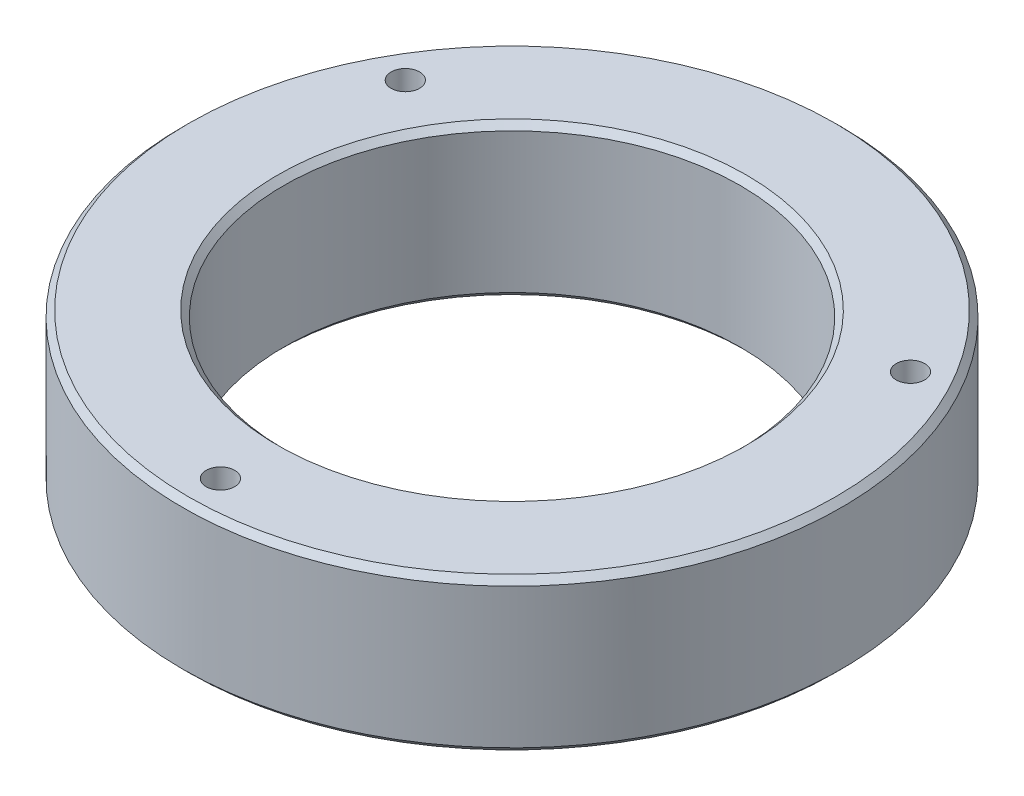
from build123d import *

# Parameters (mm, degrees)
SKETCH1_W                                        = 38.1
SKETCH1_H                                        = 25.3746
CBORE_FOR_1_4_SOCKET_HEAD_CAP_SCREW1_D           = 7.1374
CBORE_FOR_1_4_SOCKET_HEAD_CAP_SCREW1_DEPTH       = 38.1
CBORE_FOR_1_4_SOCKET_HEAD_CAP_SCREW1_CBORE_D     = 11.1252
CBORE_FOR_1_4_SOCKET_HEAD_CAP_SCREW1_CBORE_DEPTH = 9.652
CBORE_FOR_1_4_SOCKET_HEAD_CAP_SCREW1_TIP         = 2.144291291
CUT_EXTRUDE2_START                               = -19.05
SKETCH4_R                                        = 3.96875
CUT_EXTRUDE2_DEPTH                               = 25.4
CHAMFER1_SIZE                                    = 1.524


with BuildPart() as part:
    # Sketch1 → Revolve1 (revolve)
    with BuildSketch(Plane(origin=(0, 0, 0), x_dir=(0, 1, 0), z_dir=(0, 0, 1)), mode=Mode.PRIVATE) as revolve1_sk:
        with Locations((0, 69.8373)):
            Rectangle(SKETCH1_W, SKETCH1_H)
    revolve(revolve1_sk.sketch.rotate(Axis((0, -44.45, 0), (0, 1, 0)), 270), axis=Axis((0, -44.45, 0), (0, 1, 0)))

    # CBORE for 1/4 Socket Head Cap Screw1
    with Locations(Plane(origin=(0, -19.05, 0), x_dir=(-1, 0, 0), z_dir=(0, -1, 0))):
        with Locations((0, -73.025), (-63.246, 36.5252), (63.246, 36.5252)):
            CounterBoreHole(CBORE_FOR_1_4_SOCKET_HEAD_CAP_SCREW1_D / 2, CBORE_FOR_1_4_SOCKET_HEAD_CAP_SCREW1_CBORE_D / 2, CBORE_FOR_1_4_SOCKET_HEAD_CAP_SCREW1_CBORE_DEPTH, depth=CBORE_FOR_1_4_SOCKET_HEAD_CAP_SCREW1_DEPTH)
            with Locations((0, 0, -(CBORE_FOR_1_4_SOCKET_HEAD_CAP_SCREW1_DEPTH + CBORE_FOR_1_4_SOCKET_HEAD_CAP_SCREW1_TIP / 2))):  # 118° drill point
                Cone(0, CBORE_FOR_1_4_SOCKET_HEAD_CAP_SCREW1_D / 2, CBORE_FOR_1_4_SOCKET_HEAD_CAP_SCREW1_TIP, mode=Mode.SUBTRACT)

    # Sketch4 → Cut-Extrude2 (cut)
    with BuildSketch(Plane(origin=(0, 0, 0), x_dir=(-1, 0, 0), z_dir=(0, 1, 0)).offset(CUT_EXTRUDE2_START)):
        with Locations(Location((-69.85, 0, 0), (0, 0, 90))):
            Circle(SKETCH4_R)
        with Locations(Location((69.85, 0, 0), (0, 0, 90))):
            Circle(SKETCH4_R)
    extrude(amount=CUT_EXTRUDE2_DEPTH, mode=Mode.SUBTRACT)

    # Chamfer1
    chamfer1_edges = [part.edges().sort_by_distance(p)[0] for p in [
        (0, -19.05, 57.15),
        (0, 19.05, 57.15),
        (0, 19.05, 82.5246),
        (0, -19.05, 82.5246),
    ]]
    chamfer(chamfer1_edges, length=CHAMFER1_SIZE)


solid = part.part
